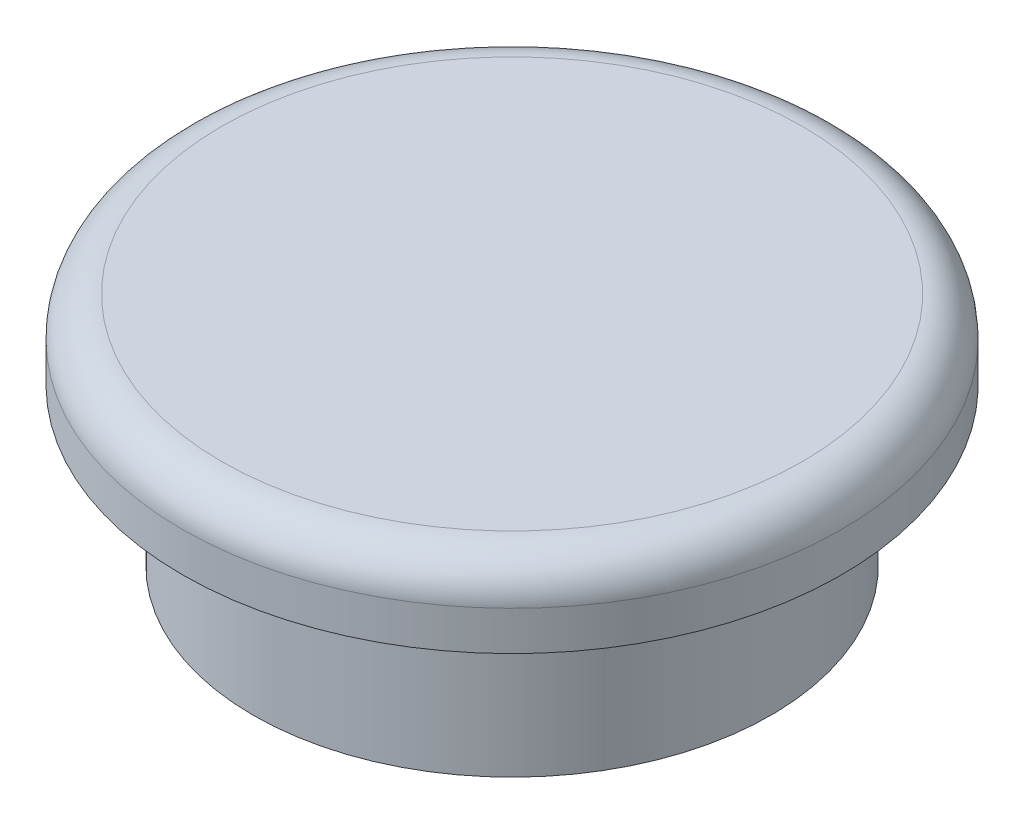
from build123d import *

# Parameters (mm, degrees)
SKETCH1_R           = 10.4775
BOSS_EXTRUDE1_DEPTH = 6.35
SKETCH2_R           = 13.335
BOSS_EXTRUDE2_DEPTH = 3.175
FILLET1_R           = 1.5875


with BuildPart() as part:
    # Sketch1 → Boss-Extrude1 (new body)
    with BuildSketch(Plane(origin=(0, 0, 0), x_dir=(1, 0, 0), z_dir=(0, 1, 0))):
        with Locations(Location((0, 0, 0), (0, 0, 270))):
            Circle(SKETCH1_R)
    extrude(amount=BOSS_EXTRUDE1_DEPTH)

    # Sketch2 → Boss-Extrude2 (add)
    with BuildSketch(Plane(origin=(0, 6.35, 0), x_dir=(1, 0, 0), z_dir=(0, 1, 0))):
        with Locations(Location((0, 0, 0), (0, 0, 270))):
            Circle(SKETCH2_R)
    extrude(amount=BOSS_EXTRUDE2_DEPTH)

    # Fillet1
    fillet1_edges = [part.edges().sort_by_distance(p)[0] for p in [
        (0, 9.525, -13.335),
    ]]
    fillet(fillet1_edges, radius=FILLET1_R)


solid = part.part
